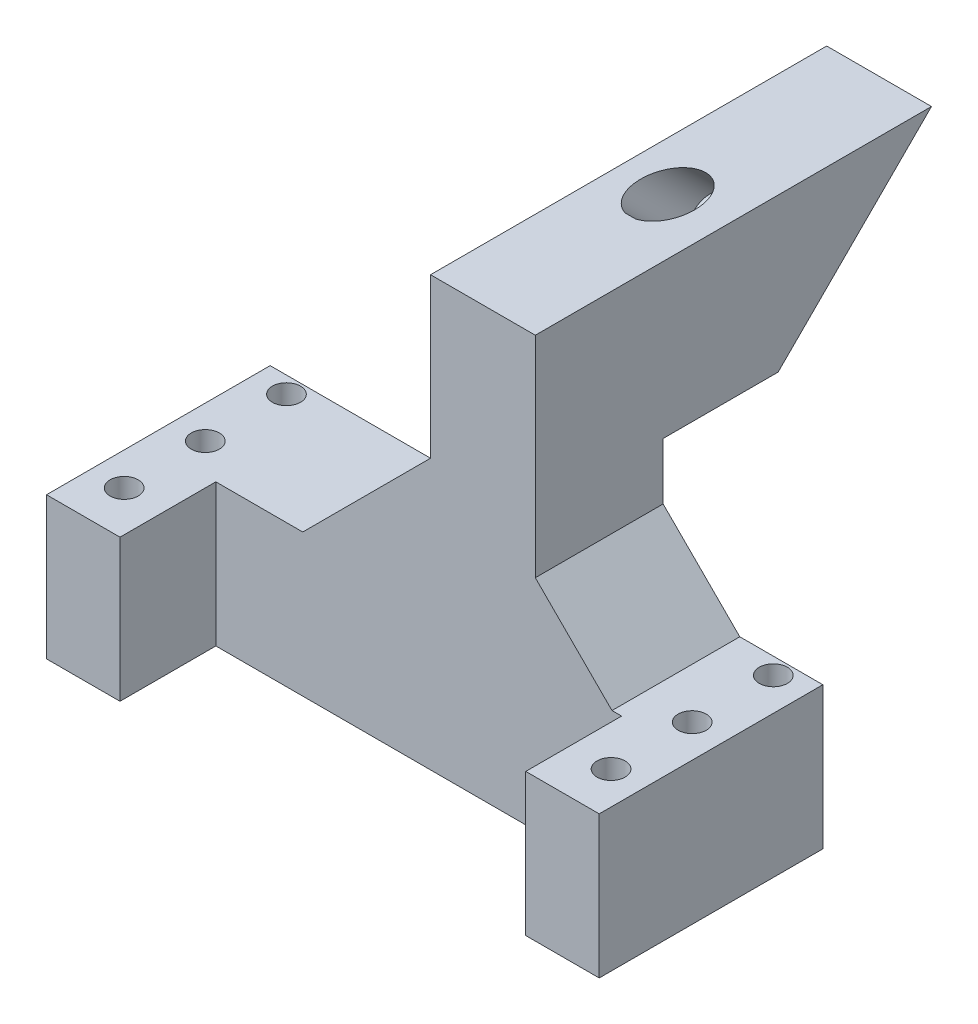
from build123d import *

# Parameters (mm, degrees)
SKETCH1_W           = 35
SKETCH1_H           = 22.25
BOSS_EXTRUDE1_DEPTH = 11.5
SKETCH2_R           = 2.2
CUT_EXTRUDE1_DEPTH  = 31.554255023
LPATTERN1_COUNT     = 3
LPATTERN1_PITCH     = 12.7
SKETCH3_W           = 20
SKETCH3_H           = 22.25
BOSS_EXTRUDE2_DEPTH = 50
SKETCH4_W           = 16.4
SKETCH4_H           = 20
BOSS_EXTRUDE3_DEPTH = 44.87
CHAMFER1_SIZE       = 20
SKETCH5_W           = 20
SKETCH5_H           = 22.25
BOSS_EXTRUDE4_DEPTH = 15
CHAMFER2_SIZE       = 12
SKETCH6_W           = 16.4
SKETCH6_H           = 24
BOSS_EXTRUDE5_DEPTH = 18
BOSS_EXTRUDE6_DEPTH = 16.4
SKETCH11_R          = 2.35
CUT_EXTRUDE4_DEPTH  = 119.961327802
SKETCH12_R          = 4.2
CUT_EXTRUDE5_DEPTH  = 16


with BuildPart() as part:
    # Sketch1 → Boss-Extrude1 (new body)
    with BuildSketch(Plane(origin=(0, 0, 0), x_dir=(0, 0, -1), z_dir=(1, 0, 0))):
        Rectangle(SKETCH1_W, SKETCH1_H)
    extrude(amount=BOSS_EXTRUDE1_DEPTH)

    # Sketch2 → Cut-Extrude1 (cut, through all)
    with BuildSketch(Plane(origin=(0, 11.125, 0), x_dir=(1, 0, 0), z_dir=(0, 1, 0))):
        with Locations(Location((5.15, -10.5, 0), (0, 0, 270))):
            Circle(SKETCH2_R)
    cut_extrude1 = extrude(amount=-CUT_EXTRUDE1_DEPTH, mode=Mode.SUBTRACT)

    # LPattern1: Cut-Extrude1 ×3
    with Locations(*[(0, 0, -i * LPATTERN1_PITCH) for i in range(1, LPATTERN1_COUNT)]):
        add(cut_extrude1, mode=Mode.SUBTRACT)


with BuildPart() as body_2:
    # Mirror3: mirrored copy
    add(part.part.mirror(Plane(origin=(43.25, 0, 0), x_dir=(0, 0, 1), z_dir=(1, 0, 0))))


with BuildPart() as part_1:
    add(part.part)

    # Sketch3 → Boss-Extrude2 (add)
    with BuildSketch(Plane(origin=(11.5, 0, 0), x_dir=(0, 0, -1), z_dir=(1, 0, 0))):
        with Locations((7.5, 0)):
            Rectangle(SKETCH3_W, SKETCH3_H)
    extrude(amount=BOSS_EXTRUDE2_DEPTH)

    # Sketch4 → Boss-Extrude3 (add)
    with BuildSketch(Plane(origin=(0, 11.125, 0), x_dir=(1, 0, 0), z_dir=(0, 1, 0))):
        with Locations((53.3, 7.5)):
            Rectangle(SKETCH4_W, SKETCH4_H)
    extrude(amount=BOSS_EXTRUDE3_DEPTH)

    # Chamfer1
    chamfer1_edges = [part_1.edges().sort_by_distance(p)[0] for p in [
        (45.1, 11.125, -7.5),
    ]]
    chamfer(chamfer1_edges, length=CHAMFER1_SIZE)

    add(body_2.part)  # Boss-Extrude4 merges body 2
    # Sketch5 → Boss-Extrude4 (add)
    with BuildSketch(Plane(origin=(61.5, 0, 0), x_dir=(0, 0, -1), z_dir=(1, 0, 0))):
        with Locations((7.5, 0)):
            Rectangle(SKETCH5_W, SKETCH5_H)
    extrude(amount=BOSS_EXTRUDE4_DEPTH)

    # Chamfer2
    chamfer2_edges = [part_1.edges().sort_by_distance(p)[0] for p in [
        (61.5, 11.125, -7.5),
    ]]
    chamfer(chamfer2_edges, length=CHAMFER2_SIZE)

    # Sketch6 → Boss-Extrude5 (add)
    with BuildSketch(Plane(origin=(0, 0, -17.5), x_dir=(-1, 0, 0), z_dir=(0, 0, -1))):
        with Locations((-53.3, 43.995)):
            Rectangle(SKETCH6_W, SKETCH6_H)
    extrude(amount=BOSS_EXTRUDE5_DEPTH)

    # Sketch7 → Boss-Extrude6 (add)
    with BuildSketch(Plane(origin=(61.5, 0, 0), x_dir=(0, 0, -1), z_dir=(1, 0, 0))):
        Polygon((35.5, 31.995), (59.5, 55.995), (35.5, 55.995), align=None)
    extrude(amount=-BOSS_EXTRUDE6_DEPTH)

    # Sketch11 → Cut-Extrude4 (cut, through all)
    with BuildSketch(Plane(origin=(0, -1.7525, -1.7525), x_dir=(1, 0, 0), z_dir=(0, -0.7071067811865509, -0.7071067811865441))):
        with Locations(Location((52.778087488, -58.643931452, 0), (0, 0, 270))):
            Circle(SKETCH11_R)
    extrude(amount=-CUT_EXTRUDE4_DEPTH, mode=Mode.SUBTRACT)

    # Sketch12 → Cut-Extrude5 (cut)
    with BuildSketch(Plane(origin=(0, 17.449710754, 17.449710754), x_dir=(1, 0, 0), z_dir=(0, 0.7071067811865464, 0.7071067811865488))):
        with Locations(Location((52.778087488, 58.643931452, 0), (0, 0, 270))):
            Circle(SKETCH12_R)
    extrude(amount=-CUT_EXTRUDE5_DEPTH, mode=Mode.SUBTRACT)


solid = part_1.part
